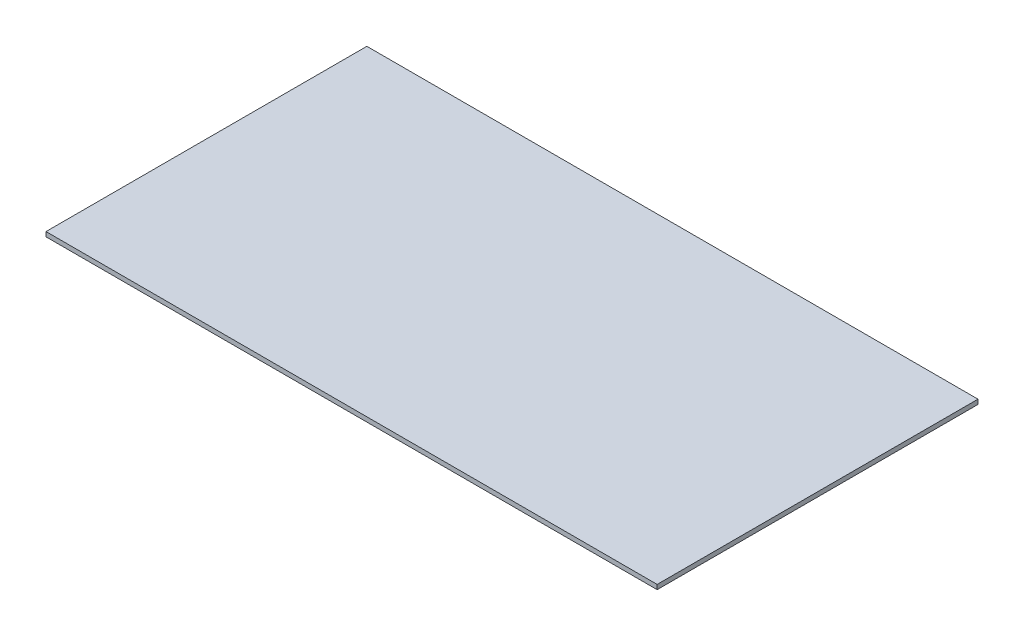
from build123d import *

# Parameters (mm, degrees)
SKETCH1_W           = 400
SKETCH1_H           = 210
BOSS_EXTRUDE1_DEPTH = 3


with BuildPart() as part:
    # Sketch1 → Boss-Extrude1 (new body)
    with BuildSketch(Plane(origin=(0, 0, 0), x_dir=(1, 0, 0), z_dir=(0, 1, 0))):
        with Locations((200, -105)):
            Rectangle(SKETCH1_W, SKETCH1_H)
    extrude(amount=BOSS_EXTRUDE1_DEPTH)


solid = part.part
